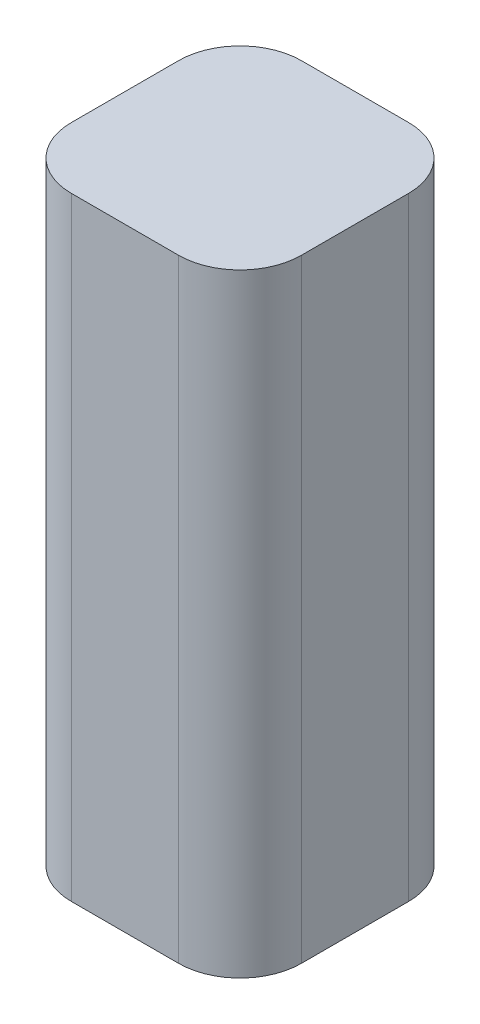
from build123d import *

# Parameters (mm, degrees)
BOSS_EXTRUDE1_DEPTH = 10


with BuildPart() as part:
    # Sketch1 → Boss-Extrude1 (new, symmetric)
    with BuildSketch(Plane(origin=(0, 0, 0), x_dir=(1, 0, 0), z_dir=(0, 1, 0))):
        with BuildLine():
            Line((-3.75, -1.75), (-3.75, 1.75))
            ThreePointArc((-3.75, 1.75), (-3.164213562, 3.164213562), (-1.75, 3.75))
            Line((-1.75, 3.75), (1.75, 3.75))
            ThreePointArc((1.75, 3.75), (3.164213562, 3.164213562), (3.75, 1.75))
            Line((3.75, 1.75), (3.75, -1.75))
            ThreePointArc((3.75, -1.75), (3.164213562, -3.164213562), (1.75, -3.75))
            Line((1.75, -3.75), (-1.75, -3.75))
            ThreePointArc((-1.75, -3.75), (-3.164213562, -3.164213562), (-3.75, -1.75))
        make_face()
    extrude(amount=BOSS_EXTRUDE1_DEPTH, both=True)


solid = part.part
